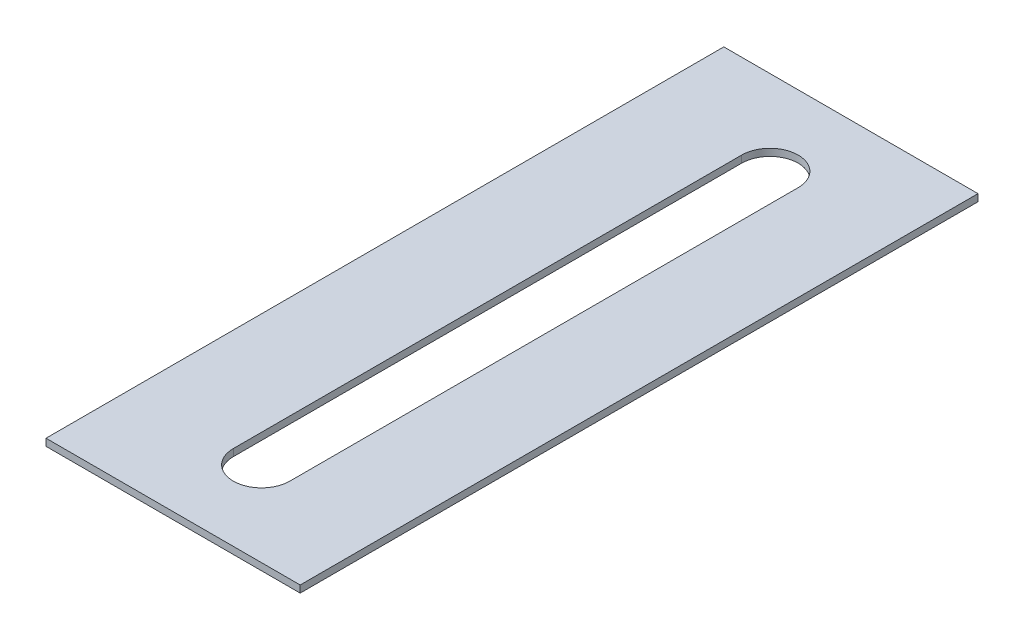
from build123d import *

# Parameters (mm, degrees)
SKETCH2_W           = 228.6
SKETCH2_H           = 609.6
BOSS_EXTRUDE1_DEPTH = 6.35
CUT_EXTRUDE1_DEPTH  = 6.35


with BuildPart() as part:
    # Sketch2 → Boss-Extrude1 (new body)
    with BuildSketch(Plane(origin=(0, 0, 0), x_dir=(1, 0, 0), z_dir=(0, 1, 0))):
        with Locations((-114.3, 304.8)):
            Rectangle(SKETCH2_W, SKETCH2_H)
    extrude(amount=BOSS_EXTRUDE1_DEPTH)

    # Sketch3 → Cut-Extrude1 (cut)
    with BuildSketch(Plane(origin=(0, 6.35, 0), x_dir=(1, 0, 0), z_dir=(0, 1, 0))):
        with BuildLine():
            Line((-136.327361064, 76.2), (-136.327361064, 533.4))
            ThreePointArc((-136.327361064, 533.4), (-110.927361064, 558.8), (-85.527361064, 533.4))
            Line((-85.527361064, 533.4), (-85.527361064, 76.2))
            ThreePointArc((-85.527361064, 76.2), (-110.927361064, 50.8), (-136.327361064, 76.2))
        make_face()
    extrude(amount=-CUT_EXTRUDE1_DEPTH, mode=Mode.SUBTRACT)


solid = part.part
